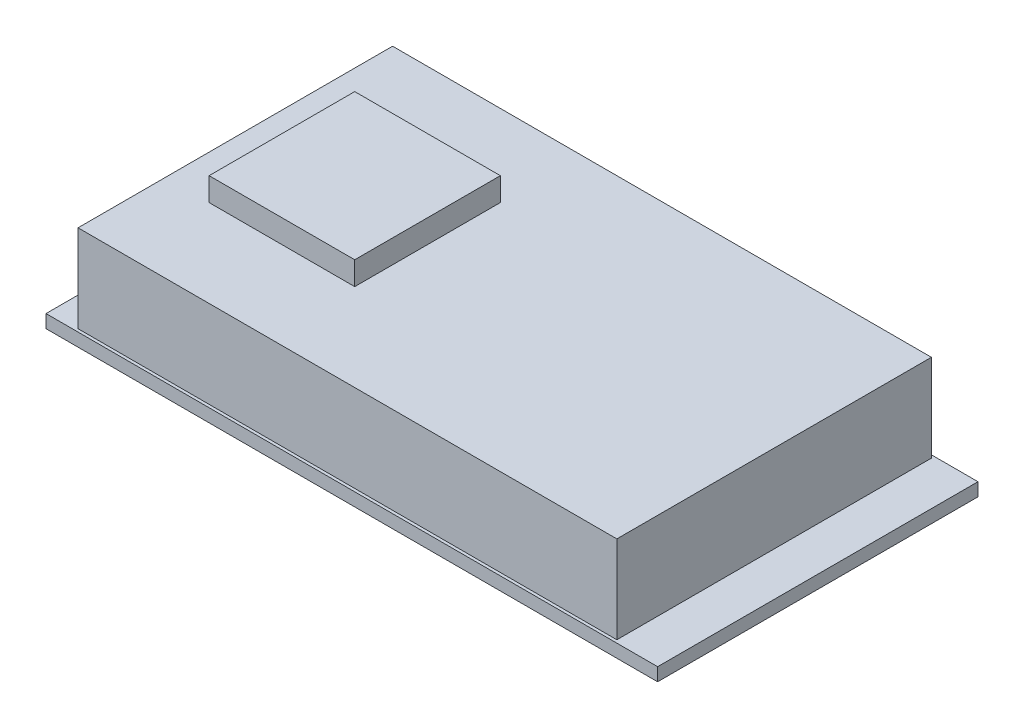
from build123d import *

# Parameters (mm, degrees)
SKETCH1_W           = 210
SKETCH1_H           = 110
BOSS_EXTRUDE1_DEPTH = 4.5
SKETCH2_W           = 185
SKETCH2_H           = 108
BOSS_EXTRUDE2_DEPTH = 30
SKETCH3_W           = 50
SKETCH3_H           = 50
BOSS_EXTRUDE3_DEPTH = 8


with BuildPart() as part:
    # Sketch1 → Boss-Extrude1 (new body)
    with BuildSketch(Plane(origin=(0, 0, 0), x_dir=(1, 0, 0), z_dir=(0, 1, 0))):
        Rectangle(SKETCH1_W, SKETCH1_H)
    extrude(amount=BOSS_EXTRUDE1_DEPTH)

    # Sketch2 → Boss-Extrude2 (add)
    with BuildSketch(Plane(origin=(0, 4.5, 0), x_dir=(1, 0, 0), z_dir=(0, 1, 0))):
        with Locations((-2.5, 0)):
            Rectangle(SKETCH2_W, SKETCH2_H)
    extrude(amount=BOSS_EXTRUDE2_DEPTH)

    # Sketch3 → Boss-Extrude3 (add)
    with BuildSketch(Plane(origin=(0, 34.5, 0), x_dir=(1, 0, 0), z_dir=(0, 1, 0))):
        with Locations((-55, 1)):
            Rectangle(SKETCH3_W, SKETCH3_H)
    extrude(amount=BOSS_EXTRUDE3_DEPTH)


solid = part.part
